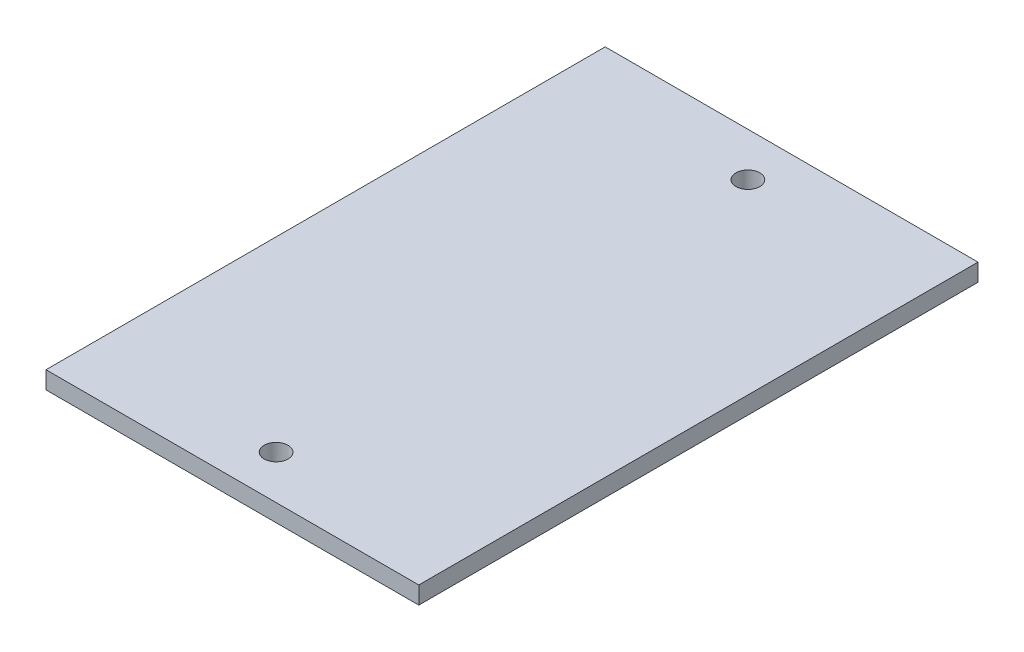
from build123d import *

# Parameters (mm, degrees)
SKETCH1_W           = 64
SKETCH1_H           = 96
SKETCH1_R           = 2.05
BOSS_EXTRUDE1_DEPTH = 3


with BuildPart() as part:
    # Sketch1 → Boss-Extrude1 (new body)
    with BuildSketch(Plane(origin=(0, 0, 0), x_dir=(1, 0, 0), z_dir=(0, 1, 0))):
        with Locations((32, -48)):
            Rectangle(SKETCH1_W, SKETCH1_H)
        with Locations(Location((32, -7.5, 0), (0, 0, 270))):
            Circle(SKETCH1_R, mode=Mode.SUBTRACT)
        with Locations(Location((32, -88.5, 0), (0, 0, 270))):
            Circle(SKETCH1_R, mode=Mode.SUBTRACT)
    extrude(amount=BOSS_EXTRUDE1_DEPTH)


solid = part.part
